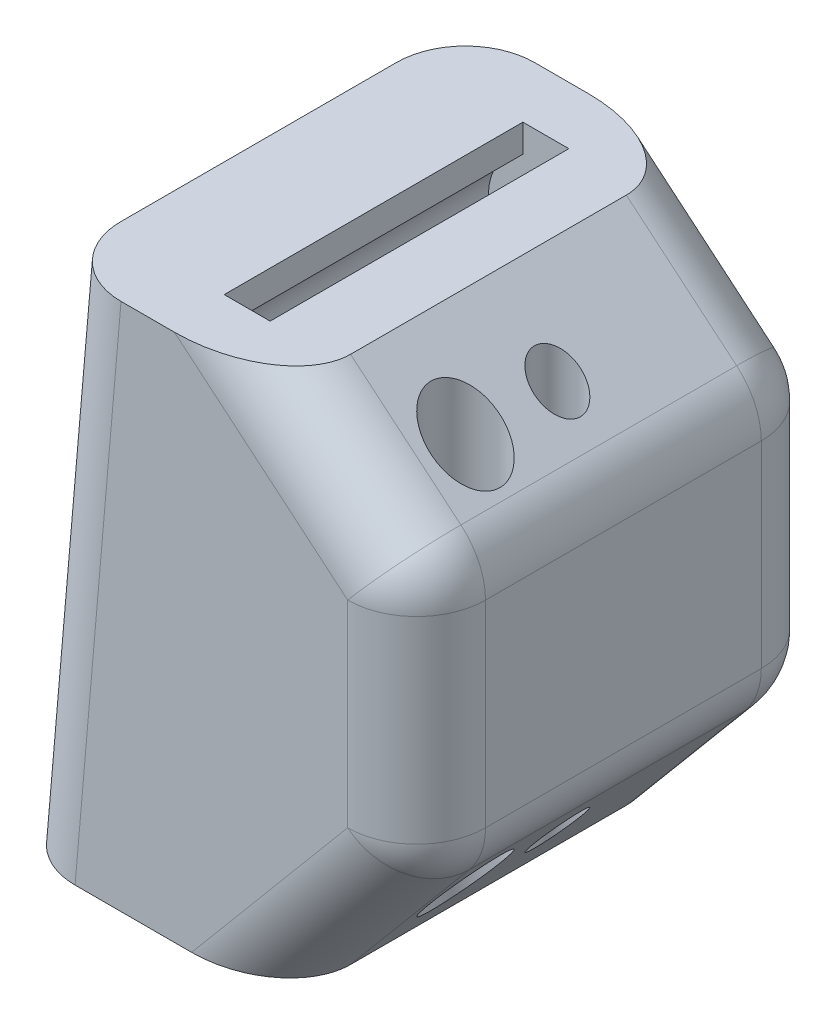
from build123d import *

# Parameters (mm, degrees)
BOSS_EXTRUDE1_DEPTH = 18
CUT_EXTRUDE1_START  = -2.5
CUT_EXTRUDE1_DEPTH  = 13
CUT_EXTRUDE2_START  = -2.5
CUT_EXTRUDE2_DEPTH  = 13
SKETCH5_R           = 1
SKETCH5_R_2         = 1.5
CUT_EXTRUDE3_DEPTH  = 25
FILLET1_R           = 3


with BuildPart() as part:
    # Sketch2 → Boss-Extrude1 (new body)
    with BuildSketch(Plane.XY):
        with BuildLine():
            Line((0, 0), (12, 0))
            Line((12, 0), (17.171830748, 6.163547874))
            ThreePointArc((17.171830748, 6.163547874), (17.692775281, 7.065850273), (17.873697418, 8.091910703))
            Line((17.873697418, 8.091910703), (17.873697418, 16.672459688))
            ThreePointArc((17.873697418, 16.672459688), (17.592620779, 17.940314473), (16.802060247, 18.970593018))
            Line((16.802060247, 18.970593018), (12, 23))
            Line((12, 23), (2, 23))
            Line((2, 23), (0, 0))
        make_face()
    extrude(amount=BOSS_EXTRUDE1_DEPTH)

    # Sketch3 → Cut-Extrude1 (cut)
    with BuildSketch(Plane.XY.offset(18).offset(CUT_EXTRUDE1_START)):
        with BuildLine():
            Line((7, 23), (9, 23))
            Line((9, 23), (9, 21.791287847))
            ThreePointArc((9, 21.791287847), (8, 17), (7, 21.791287847))
            Line((7, 21.791287847), (7, 23))
        make_face()
    extrude(amount=-CUT_EXTRUDE1_DEPTH, mode=Mode.SUBTRACT)

    # Sketch4 → Cut-Extrude2 (cut)
    with BuildSketch(Plane(origin=(0, 0, 0), x_dir=(-1, 0, 0), z_dir=(0, 0, -1)).offset(CUT_EXTRUDE2_START)):
        with BuildLine():
            Line((-9, 0), (-7, 0))
            Line((-7, 0), (-7, 1.208712153))
            ThreePointArc((-7, 1.208712153), (-8, 6), (-9, 1.208712153))
            Line((-9, 1.208712153), (-9, 0))
        make_face()
    extrude(amount=-CUT_EXTRUDE2_DEPTH, mode=Mode.SUBTRACT)

    # Sketch5 → Cut-Extrude3 (cut)
    with BuildSketch(Plane(origin=(0, 0, 0), x_dir=(1, 0, 0), z_dir=(0, 1, 0))):
        with Locations((15, -9)):
            Circle(SKETCH5_R)
        with Locations((15, -13)):
            Circle(SKETCH5_R_2)
    extrude(amount=CUT_EXTRUDE3_DEPTH, mode=Mode.SUBTRACT)

    # Fillet1
    fillet1_edges = [part.edges().sort_by_distance(p)[0] for p in [
        (17.692775281, 7.065850273, 0),
        (14.585915374, 3.081773937, 0),
        (1, 11.5, 0),
        (14.585915374, 3.081773937, 18),
        (17.692775281, 7.065850273, 18),
        (17.873697418, 12.382185196, 18),
        (17.592620779, 17.940314473, 18),
        (14.401030124, 20.985296509, 18),
        (1, 11.5, 18),
        (14.401030124, 20.985296509, 0),
        (17.592620779, 17.940314473, 0),
        (17.873697418, 12.382185196, 0),
    ]]
    fillet(fillet1_edges, radius=FILLET1_R)


solid = part.part
